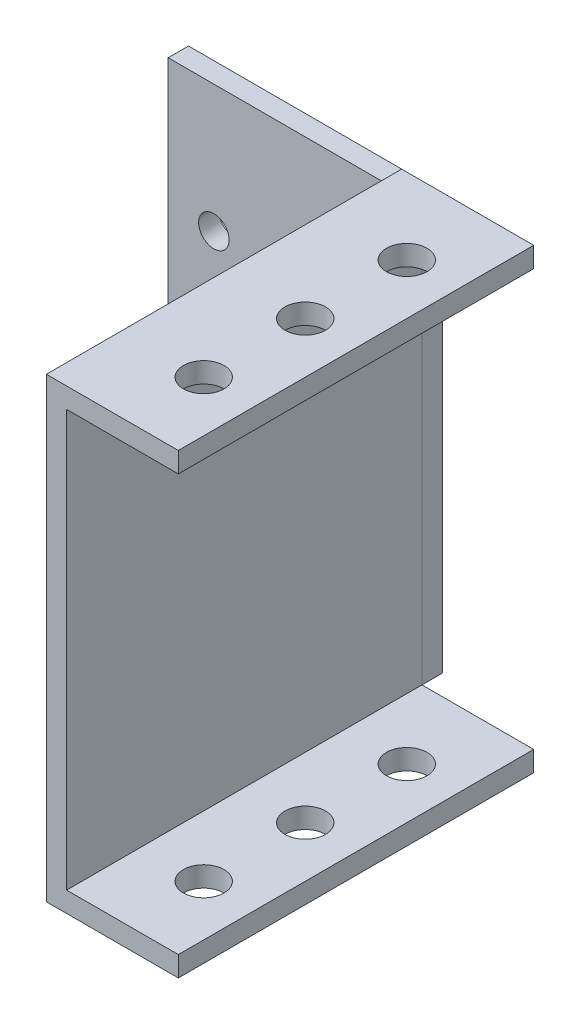
from build123d import *

# Parameters (mm, degrees)
BOSS_EXTRUDE1_DEPTH = 35
SKETCH2_W           = 25
SKETCH2_H           = 41
BOSS_EXTRUDE2_DEPTH = 2
SKETCH3_R           = 1.5
CUT_EXTRUDE1_DEPTH  = 2
SKETCH4_R           = 2
CUT_EXTRUDE2_DEPTH  = 62.473571557


with BuildPart() as part:
    # Sketch1 → Boss-Extrude1 (new body)
    with BuildSketch(Plane.XY):
        Polygon((0, 0), (0, 45), (13, 45), (13, 43), (2, 43), (2, 2), (13, 2), (13, 0), align=None)
    extrude(amount=BOSS_EXTRUDE1_DEPTH)

    # Sketch4 → Cut-Extrude2 (cut, through all)
    with BuildSketch(Plane(origin=(0, 45, 0), x_dir=(1, 0, 0), z_dir=(0, 1, 0))):
        with Locations(Location((8, -17.5, 0), (0, 0, 270))):
            Circle(SKETCH4_R)
        with Locations(Location((8, -27.5, 0), (0, 0, 270))):
            Circle(SKETCH4_R)
        with Locations(Location((8, -7.5, 0), (0, 0, 270))):
            Circle(SKETCH4_R)
    extrude(amount=-CUT_EXTRUDE2_DEPTH, mode=Mode.SUBTRACT)


with BuildPart() as body_2:
    # Sketch2 → Boss-Extrude2 (new body)
    with BuildSketch(Plane(origin=(0, 0, 0), x_dir=(-1, 0, 0), z_dir=(0, 0, -1))):
        with Locations((10.5, 22.5)):
            Rectangle(SKETCH2_W, SKETCH2_H)
    extrude(amount=BOSS_EXTRUDE2_DEPTH)

    # Sketch3 → Cut-Extrude1 (cut)
    with BuildSketch(Plane(origin=(0, 0, -2), x_dir=(-1, 0, 0), z_dir=(0, 0, -1))):
        with Locations((18.5, 30.45)):
            Circle(SKETCH3_R)
        with Locations((3.5, 30.45)):
            Circle(SKETCH3_R)
        with Locations(Location((18.5, 14.45, 0), (0, 0, 180))):
            Circle(SKETCH3_R)
        with Locations(Location((3.5, 14.45, 0), (0, 0, 180))):
            Circle(SKETCH3_R)
    extrude(amount=-CUT_EXTRUDE1_DEPTH, mode=Mode.SUBTRACT)


solid = Compound([part.part, body_2.part])
